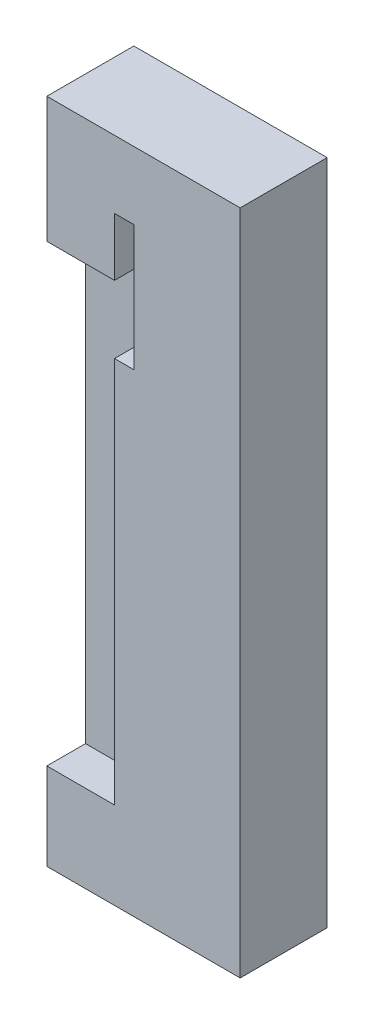
from build123d import *

# Parameters (mm, degrees)
ESQUISSE1_W             = 20
ESQUISSE1_H             = 69
EXTRUSION1_DEPTH        = 9
ESQUISSE2_W             = 7
ESQUISSE2_H             = 47
ENL_V_MAT_EXTRU_1_DEPTH = 4
ESQUISSE3_W             = 2
ESQUISSE3_H             = 13
ENL_V_MAT_EXTRU_2_DEPTH = 5


with BuildPart() as part:
    # Esquisse1 → Extrusion1 (new body)
    with BuildSketch(Plane.XY):
        with Locations((-5.903123543, -29.411538462)):
            Rectangle(ESQUISSE1_W, ESQUISSE1_H)
    extrude(amount=EXTRUSION1_DEPTH)

    # Esquisse2 → Enlèv. mat.-Extru.1 (cut)
    with BuildSketch(Plane.XY.offset(9)):
        with Locations((-12.403123543, -31.411538462)):
            Rectangle(ESQUISSE2_W, ESQUISSE2_H)
    extrude(amount=-ENL_V_MAT_EXTRU_1_DEPTH, mode=Mode.SUBTRACT)

    # Esquisse3 → Enlèv. mat.-Extru.2 (cut)
    with BuildSketch(Plane.XY.offset(9)):
        with Locations((-7.903123543, -8.411538462)):
            Rectangle(ESQUISSE3_W, ESQUISSE3_H)
    extrude(amount=-ENL_V_MAT_EXTRU_2_DEPTH, mode=Mode.SUBTRACT)


solid = part.part
